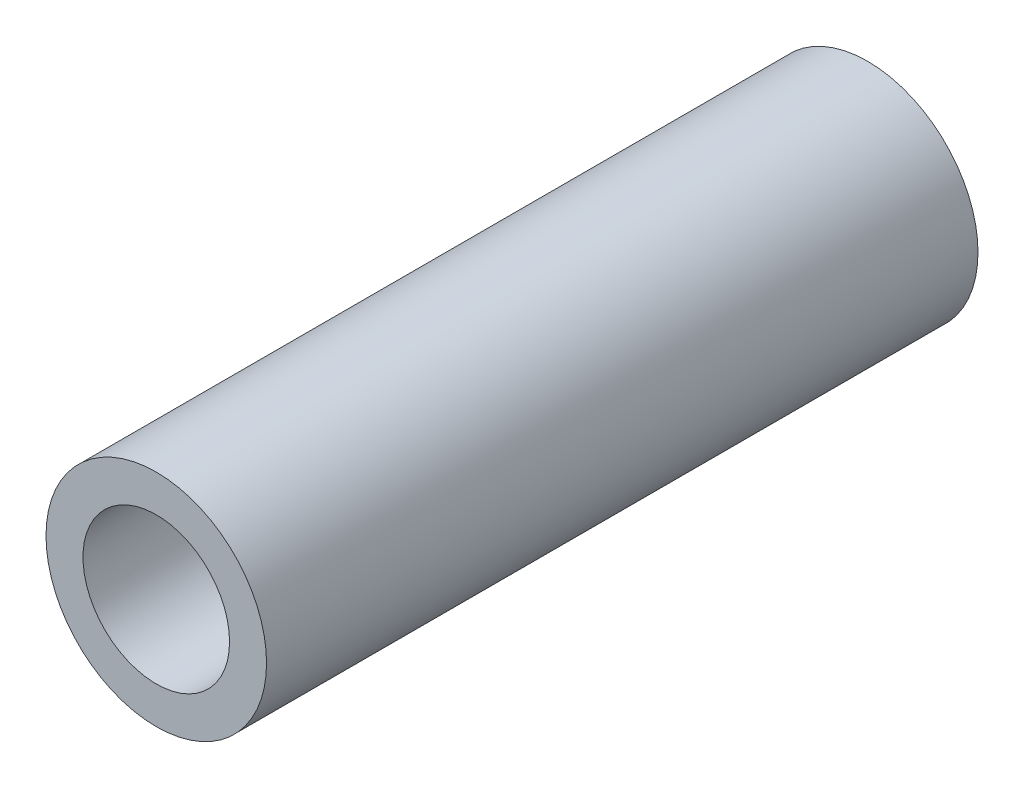
from build123d import *

# Parameters (mm, degrees)
SKETCH1_R           = 3.1
SKETCH1_R_2         = 2.06
BOSS_EXTRUDE1_DEPTH = 20


with BuildPart() as part:
    # Sketch1 → Boss-Extrude1 (new body)
    with BuildSketch(Plane(origin=(0, 0, 0), x_dir=(0, 1, 0), z_dir=(0, 0, 1))):
        with Locations(Location((0, 0, 0), (0, 0, 270))):
            Circle(SKETCH1_R)
        with Locations(Location((0, 0, 0), (0, 0, 270))):
            Circle(SKETCH1_R_2, mode=Mode.SUBTRACT)
    extrude(amount=BOSS_EXTRUDE1_DEPTH)


solid = part.part
